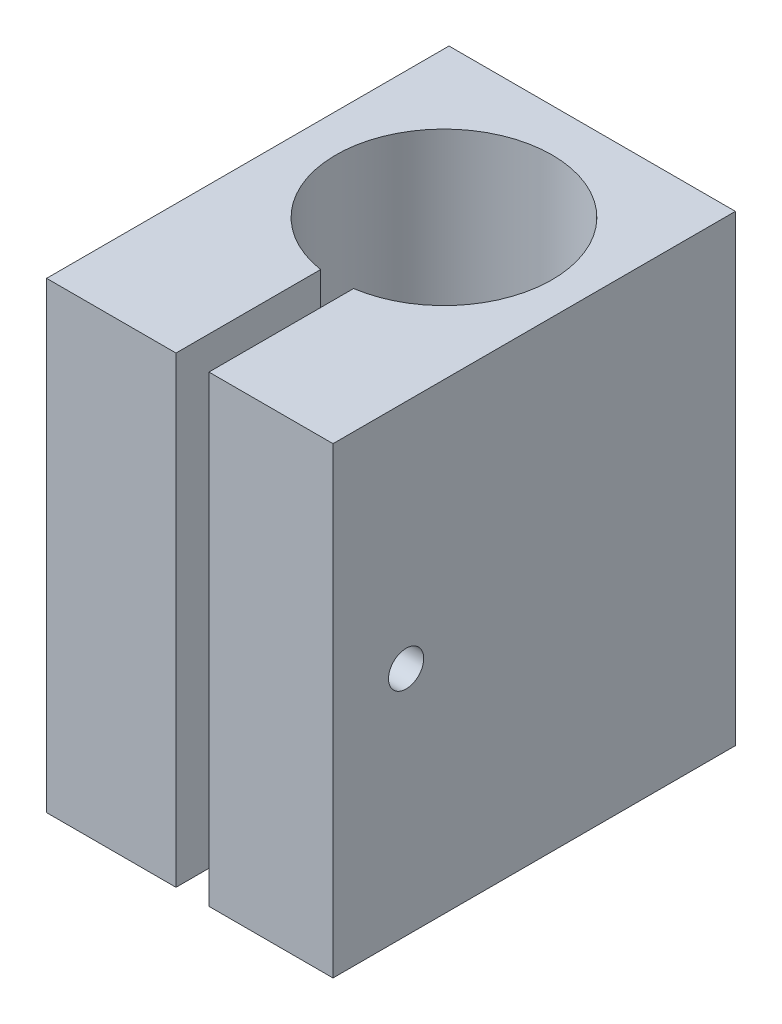
from build123d import *

# Parameters (mm, degrees)
EXTRUDE_1_DEPTH     = 46
CUT_EXTRUDE_1_DEPTH = 3
SKETCH_3_R          = 1.75
CUT_EXTRUDE_2_DEPTH = 57.25585214


with BuildPart() as part:
    # Эскиз1 → Бобышка-Вытянуть1 (new body)
    with BuildSketch(Plane(origin=(0, 0, 0), x_dir=(1, 0, 0), z_dir=(0, 1, 0))):
        with BuildLine():
            Line((-14.235, 20), (14.235, 20))
            Line((14.235, 20), (14.235, -20))
            Line((14.235, -20), (1.903095238, -20))
            Line((1.903095238, -20), (1.903095238, -5.624459703))
            ThreePointArc((1.903095238, -5.624459703), (0.265, 15.75), (-1.373095238, -5.624459703))
            Line((-1.373095238, -5.624459703), (-1.373095238, -20))
            Line((-1.373095238, -20), (-14.235, -20))
            Line((-14.235, -20), (-14.235, 20))
        make_face()
    extrude(amount=EXTRUDE_1_DEPTH)

    # Эскиз2 → Вырез-Вытянуть1 (cut)
    with BuildSketch(Plane.ZY.offset(14.235)):
        Polygon((12.733013434, 19.75), (15.547595996, 21.375), (15.547595996, 24.625), (12.733013434, 26.25), (9.918430872, 24.625), (9.918430872, 21.375), align=None)
    extrude(amount=-CUT_EXTRUDE_1_DEPTH, mode=Mode.SUBTRACT)

    # Эскиз3 → Вырез-Вытянуть2 (cut, through all)
    with BuildSketch(Plane.ZY.offset(11.235)):
        with Locations((12.733013434, 23)):
            Circle(SKETCH_3_R)
    extrude(amount=-CUT_EXTRUDE_2_DEPTH, mode=Mode.SUBTRACT)


solid = part.part
